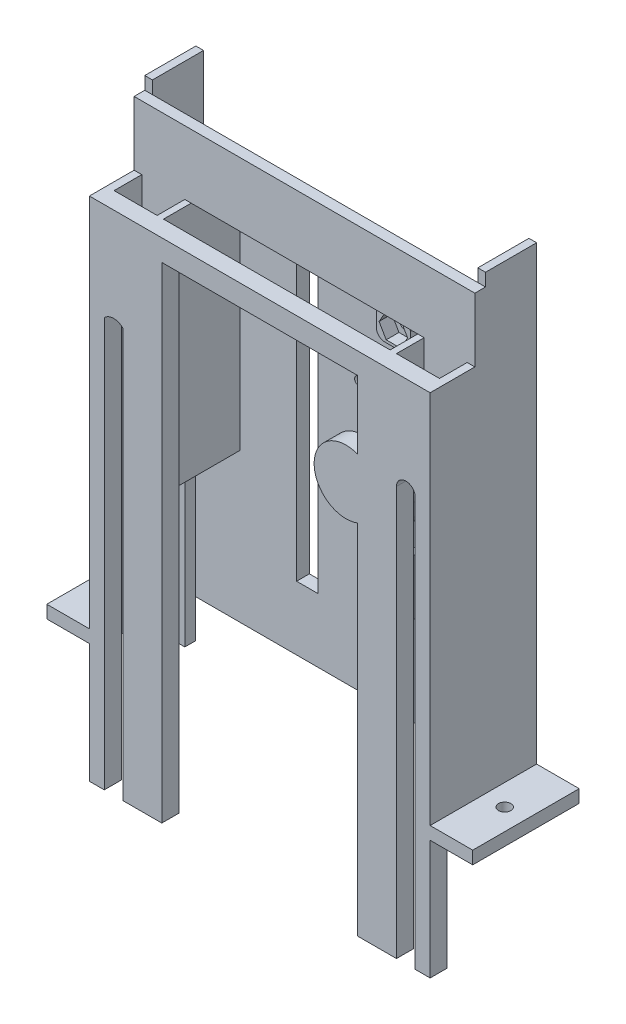
from build123d import *

# Parameters (mm, degrees)
SKETCH1_W            = 9.1
SKETCH1_H            = 51
SKETCH1_W_2          = 23
SKETCH1_H_2          = 5
BOSS_EXTRUDE1_DEPTH  = 4
SKETCH2_W            = 1.8
SKETCH2_H            = 56
SKETCH2_W_2          = 1.5
BOSS_EXTRUDE2_DEPTH  = 5
SKETCH3_W            = 1.5
SKETCH3_H            = 30
CUT_EXTRUDE1_DEPTH   = 5
SKETCH4_W            = 1.8
SKETCH4_H            = 13
SKETCH4_W_2          = 1.5
SKETCH4_H_2          = 3
SKETCH4_W_3          = 10.1
SKETCH4_W_4          = 53.2
BOSS_EXTRUDE3_DEPTH  = 56
SKETCH5_R            = 1.75
SKETCH5_R_2          = 4.75
CUT_EXTRUDE2_DEPTH   = 3
SKETCH6_W            = 8
SKETCH6_H            = 7
BOSS_EXTRUDE4_DEPTH  = 3
FILLET1_R            = 2
SKETCH7_W            = 1.5
SKETCH7_H            = 30
CUT_EXTRUDE3_DEPTH   = 7
SKETCH8_W            = 5
SKETCH8_H            = 50
CUT_EXTRUDE4_DEPTH   = 3
SKETCH11_W           = 7
SKETCH11_H           = 3
BOSS_EXTRUDE5_DEPTH  = 10
SKETCH12_W           = 25
SKETCH12_H           = 3
BOSS_EXTRUDE6_DEPTH  = 10
SKETCH13_W           = 25
SKETCH13_H           = 3
BOSS_EXTRUDE7_DEPTH  = 10
SKETCH14_R           = 1.75
CUT_EXTRUDE6_DEPTH   = 3
BOSS_EXTRUDE8_START  = -4
BOSS_EXTRUDE8_DEPTH  = 4
SKETCH17_W           = 3.4
SKETCH17_H           = 32.199052503
CUT_EXTRUDE8_DEPTH   = 4
SKETCH18_W           = 23
SKETCH18_H           = 12
CUT_EXTRUDE9_DEPTH   = 10
SKETCH19_W           = 76.4
SKETCH19_H           = 18
BOSS_EXTRUDE10_DEPTH = 35
SKETCH21_R           = 1.45
CUT_EXTRUDE11_DEPTH  = 109.360509412
SKETCH20_W           = 10
SKETCH20_H           = 25
SKETCH20_W_2         = 7
SKETCH20_H_2         = 10
CUT_EXTRUDE10_DEPTH  = 35
SKETCH22_W           = 4.4
SKETCH22_H           = 35
CUT_EXTRUDE12_DEPTH  = 10
SKETCH23_W           = 46
SKETCH23_H           = 35
CUT_EXTRUDE13_DEPTH  = 10
SKETCH25_W           = 1.8
SKETCH25_H           = 12
BOSS_EXTRUDE12_DEPTH = 18
SKETCH27_R           = 1
CUT_EXTRUDE15_DEPTH  = 5
SKETCH28_W           = 7
SKETCH28_H           = 10
CUT_EXTRUDE16_DEPTH  = 122.231184107
SKETCH29_W           = 7
SKETCH29_H           = 10
BOSS_EXTRUDE13_DEPTH = 2
SKETCH30_R           = 1.5
CUT_EXTRUDE17_DEPTH  = 109.360509412
BOSS_EXTRUDE14_DEPTH = 4
SKETCH33_W           = 3.5
SKETCH33_H           = 4
SKETCH33_W_2         = 9.1
BOSS_EXTRUDE15_DEPTH = 28
BOSS_EXTRUDE16_DEPTH = 4
SKETCH35_W           = 80
SKETCH35_H           = 15
BOSS_EXTRUDE17_DEPTH = 2.5
SKETCH36_W           = 10.1
SKETCH36_H           = 2.5
BOSS_EXTRUDE18_DEPTH = 91
SKETCH37_W           = 5
SKETCH37_H           = 20
CUT_EXTRUDE18_DEPTH  = 5


with BuildPart() as part:
    # Sketch1 → Boss-Extrude1 (new body)
    with BuildSketch(Plane.XY):
        with BuildLine():
            Line((-23, 23), (-23, 28))
            Line((-23, 28), (-40, 28))
            Line((-40, 28), (-40, -28))
            Line((-40, -28), (-36.5, -28))
            Line((-36.5, -28), (-36.5, 23))
            ThreePointArc((-36.5, 23), (-34.3, 25.2), (-32.1, 23))
            Line((-32.1, 23), (-23, 23))
        make_face()
        with Locations((-27.55, -2.5)):
            Rectangle(SKETCH1_W, SKETCH1_H)
        with Locations((-11.5, 25.5)):
            Rectangle(SKETCH1_W_2, SKETCH1_H_2)
        with Locations((27.55, -2.5)):
            Rectangle(SKETCH1_W, SKETCH1_H)
        with Locations((11.5, 25.5)):
            Rectangle(SKETCH1_W_2, SKETCH1_H_2)
        with BuildLine():
            Line((40, 28), (23, 28))
            Line((23, 28), (23, 23))
            Line((23, 23), (32.1, 23))
            ThreePointArc((32.1, 23), (34.3, 25.2), (36.5, 23))
            Line((36.5, 23), (36.5, -28))
            Line((36.5, -28), (40, -28))
            Line((40, -28), (40, 28))
        make_face()
    extrude(amount=BOSS_EXTRUDE1_DEPTH)

    # Sketch2 → Boss-Extrude2 (add)
    with BuildSketch(Plane(origin=(0, 0, 0), x_dir=(-1, 0, 0), z_dir=(0, 0, -1))):
        with Locations((-39.1, 0)):
            Rectangle(SKETCH2_W, SKETCH2_H)
        with Locations((-27.35, 0)):
            Rectangle(SKETCH2_W_2, SKETCH2_H)
        with Locations((27.35, 0)):
            Rectangle(SKETCH2_W_2, SKETCH2_H)
        with Locations((39.1, 0)):
            Rectangle(SKETCH2_W, SKETCH2_H)
    extrude(amount=BOSS_EXTRUDE2_DEPTH)

    # Sketch3 → Cut-Extrude1 (cut)
    with BuildSketch(Plane(origin=(0, 0, -5), x_dir=(-1, 0, 0), z_dir=(0, 0, -1))):
        with Locations((-27.35, 0)):
            Rectangle(SKETCH3_W, SKETCH3_H)
    extrude(amount=-CUT_EXTRUDE1_DEPTH, mode=Mode.SUBTRACT)

    # Sketch4 → Boss-Extrude3 (add)
    with BuildSketch(Plane(origin=(0, 28, 0), x_dir=(1, 0, 0), z_dir=(0, 1, 0))):
        with Locations((-39.1, 11.5)):
            Rectangle(SKETCH4_W, SKETCH4_H)
        with Locations((-27.35, 11.5)):
            Rectangle(SKETCH4_W_2, SKETCH4_H)
        with Locations((-27.35, 19.5)):
            Rectangle(SKETCH4_W_2, SKETCH4_H_2)
        with Locations((-33.15, 19.5)):
            Rectangle(SKETCH4_W_3, SKETCH4_H_2)
        with Locations((-39.1, 19.5)):
            Rectangle(SKETCH4_W, SKETCH4_H_2)
        with Locations((0, 19.5)):
            Rectangle(SKETCH4_W_4, SKETCH4_H_2)
        with Locations((27.35, 11.5)):
            Rectangle(SKETCH4_W_2, SKETCH4_H)
        with Locations((27.35, 19.5)):
            Rectangle(SKETCH4_W_2, SKETCH4_H_2)
        with Locations((33.15, 19.5)):
            Rectangle(SKETCH4_W_3, SKETCH4_H_2)
        with Locations((39.1, 19.5)):
            Rectangle(SKETCH4_W, SKETCH4_H_2)
        with Locations((39.1, 11.5)):
            Rectangle(SKETCH4_W, SKETCH4_H)
    extrude(amount=-BOSS_EXTRUDE3_DEPTH)

    # Sketch5 → Cut-Extrude2 (cut)
    with BuildSketch(Plane(origin=(0, 0, -21), x_dir=(-1, 0, 0), z_dir=(0, 0, -1))):
        with Locations((-12.36, 17.5)):
            Circle(SKETCH5_R)
        with Locations((-12.36, -17.5)):
            Circle(SKETCH5_R)
        with Locations((-20.26, 0)):
            Circle(SKETCH5_R_2)
    extrude(amount=-CUT_EXTRUDE2_DEPTH, mode=Mode.SUBTRACT)

    # Sketch6 → Boss-Extrude4 (add)
    # profile 1 of 2: a face of its own
    with BuildSketch(Plane.XY.offset(-18)):
        with Locations((12.36, 17.5)):
            Rectangle(SKETCH6_W, SKETCH6_H)
        Polygon((10.685684219, 14.6), (14.034315781, 14.6), (15.708631561, 17.5), (14.034315781, 20.4), (10.685684219, 20.4), (9.011368439, 17.5), align=None, mode=Mode.SUBTRACT)
    # profile 2 of 2: a face of its own
    with BuildSketch(Plane.XY.offset(-18)):
        with Locations((12.36, -17.5)):
            Rectangle(SKETCH6_W, SKETCH6_H)
        Polygon((10.685684219, -20.4), (14.034315781, -20.4), (15.708631561, -17.5), (14.034315781, -14.6), (10.685684219, -14.6), (9.011368439, -17.5), align=None, mode=Mode.SUBTRACT)
    extrude(amount=BOSS_EXTRUDE4_DEPTH)

    # Fillet1
    fillet1_edges = [part.edges().sort_by_distance(p)[0] for p in [
        (16.36, 14, -16.5),
        (16.36, 21, -16.5),
        (8.36, 21, -16.5),
        (8.36, 14, -16.5),
        (16.36, -21, -16.5),
        (16.36, -14, -16.5),
        (8.36, -14, -16.5),
        (8.36, -21, -16.5),
    ]]
    fillet(fillet1_edges, radius=FILLET1_R)

    # Sketch7 → Cut-Extrude3 (cut)
    with BuildSketch(Plane.XY.offset(-5)):
        with Locations((27.35, 0)):
            Rectangle(SKETCH7_W, SKETCH7_H)
    extrude(amount=-CUT_EXTRUDE3_DEPTH, mode=Mode.SUBTRACT)

    # Sketch8 → Cut-Extrude4 (cut)
    with BuildSketch(Plane(origin=(0, 0, -21), x_dir=(-1, 0, 0), z_dir=(0, 0, -1))):
        with Locations((10.85, -3)):
            Rectangle(SKETCH8_W, SKETCH8_H)
        with BuildLine():
            ThreePointArc((8.35, 22), (10.85, 24.5), (13.35, 22))
            Line((13.35, 22), (8.35, 22))
        make_face()
    extrude(amount=-CUT_EXTRUDE4_DEPTH, mode=Mode.SUBTRACT)

    # Sketch11 → Boss-Extrude5 (add)
    with BuildSketch(Plane(origin=(0, 0, -21), x_dir=(-1, 0, 0), z_dir=(0, 0, -1))):
        with Locations((-20.5, -26.5)):
            Rectangle(SKETCH11_W, SKETCH11_H)
        with Locations((20.5, -26.5)):
            Rectangle(SKETCH11_W, SKETCH11_H)
    extrude(amount=BOSS_EXTRUDE5_DEPTH)

    # Sketch12 → Boss-Extrude6 (add)
    with BuildSketch(Plane(origin=(40, 0, 0), x_dir=(0, 0, -1), z_dir=(1, 0, 0))):
        with Locations((8.5, -26.5)):
            Rectangle(SKETCH12_W, SKETCH12_H)
    extrude(amount=BOSS_EXTRUDE6_DEPTH)

    # Sketch13 → Boss-Extrude7 (add)
    with BuildSketch(Plane.ZY.offset(40)):
        with Locations((-8.5, -26.5)):
            Rectangle(SKETCH13_W, SKETCH13_H)
    extrude(amount=BOSS_EXTRUDE7_DEPTH)

    # Sketch14 → Cut-Extrude6 (cut)
    with BuildSketch(Plane(origin=(0, -25, 0), x_dir=(1, 0, 0), z_dir=(0, 1, 0))):
        with Locations(Location((20.5, 26, 0), (0, 0, 180))):
            Circle(SKETCH14_R)
        with Locations(Location((45, 8.5, 0), (0, 0, 180))):
            Circle(SKETCH14_R)
        with Locations(Location((-20.5, 26, 0), (0, 0, 180))):
            Circle(SKETCH14_R)
        with Locations(Location((-45, 8.5, 0), (0, 0, 180))):
            Circle(SKETCH14_R)
    extrude(amount=-CUT_EXTRUDE6_DEPTH, mode=Mode.SUBTRACT)

    # Sketch15 → Boss-Extrude8 (add)
    with BuildSketch(Plane.XY.offset(4).offset(BOSS_EXTRUDE8_START)):
        with BuildLine():
            ThreePointArc((23, 3.880064432), (24.477671158, 2.184891302), (25.01, 0))
            ThreePointArc((25.01, 0), (24.477671158, -2.184891302), (23, -3.880064432))
            Line((23, -3.880064432), (23, -6.981575753))
            ThreePointArc((23, -6.981575753), (26.456773354, -4.224926035), (27.76, 0))
            ThreePointArc((27.76, 0), (26.456773354, 4.224926035), (23, 6.981575753))
            Line((23, 6.981575753), (23, 3.880064432))
        make_face()
        with BuildLine():
            ThreePointArc((23, -3.880064432), (15.51, 0), (23, 3.880064432))
            Line((23, 3.880064432), (23, 6.981575753))
            ThreePointArc((23, 6.981575753), (12.76, 0), (23, -6.981575753))
            Line((23, -6.981575753), (23, -3.880064432))
        make_face()
        with BuildLine():
            ThreePointArc((23, -3.880064432), (24.477671158, -2.184891302), (25.01, 0))
            ThreePointArc((25.01, 0), (24.477671158, 2.184891302), (23, 3.880064432))
            Line((23, 3.880064432), (23, -3.880064432))
        make_face()
        with BuildLine():
            Line((23, -3.880064432), (23, 3.880064432))
            ThreePointArc((23, 3.880064432), (15.51, 0), (23, -3.880064432))
        make_face()
    extrude(amount=BOSS_EXTRUDE8_DEPTH)

    # Sketch17 → Cut-Extrude8 (cut)
    with BuildSketch(Plane(origin=(0, 0, -21), x_dir=(-1, 0, 0), z_dir=(0, 0, -1))):
        with Locations((34.3, 6.900473748)):
            Rectangle(SKETCH17_W, SKETCH17_H)
        with Locations((-34.3, 6.900473748)):
            Rectangle(SKETCH17_W, SKETCH17_H)
    extrude(amount=-CUT_EXTRUDE8_DEPTH, mode=Mode.SUBTRACT)

    # Sketch18 → Cut-Extrude9 (cut)
    with BuildSketch(Plane(origin=(0, 0, -21), x_dir=(-1, 0, 0), z_dir=(0, 0, -1))):
        with Locations((-14.76, 0)):
            Rectangle(SKETCH18_W, SKETCH18_H)
    extrude(amount=-CUT_EXTRUDE9_DEPTH, mode=Mode.SUBTRACT)

    # Sketch19 → Boss-Extrude10 (add)
    with BuildSketch(Plane.XZ.offset(28)):
        Polygon((-50, 4), (-38.2, 4), (38.2, 4), (50, 4), (50, -21), (38.2, -21), (24, -21), (24, -31), (17, -31), (17, -21), (-17, -21), (-17, -31), (-24, -31), (-24, -21), (-38.2, -21), (-50, -21), align=None)
        with Locations((0, -9)):
            Rectangle(SKETCH19_W, SKETCH19_H, mode=Mode.SUBTRACT)
    extrude(amount=BOSS_EXTRUDE10_DEPTH)

    # Sketch21 → Cut-Extrude11 (cut, through all)
    with BuildSketch(Plane.XZ.offset(63)):
        with Locations(Location((45, -8.5, 0), (0, 0, 270))):
            Circle(SKETCH21_R)
        with Locations(Location((20.5, -26, 0), (0, 0, 270))):
            Circle(SKETCH21_R)
        with Locations(Location((-20.5, -26, 0), (0, 0, 270))):
            Circle(SKETCH21_R)
        with Locations(Location((-45, -8.5, 0), (0, 0, 270))):
            Circle(SKETCH21_R)
    extrude(amount=-CUT_EXTRUDE11_DEPTH, mode=Mode.SUBTRACT)

    # Sketch20 → Cut-Extrude10 (cut)
    with BuildSketch(Plane(origin=(0, -25, 0), x_dir=(1, 0, 0), z_dir=(0, 1, 0))):
        with Locations((-45, 8.5)):
            Rectangle(SKETCH20_W, SKETCH20_H)
        with Locations((45, 8.5)):
            Rectangle(SKETCH20_W, SKETCH20_H)
        with Locations((-20.5, 26)):
            Rectangle(SKETCH20_W_2, SKETCH20_H_2)
        with Locations((20.5, 26)):
            Rectangle(SKETCH20_W_2, SKETCH20_H_2)
    extrude(amount=-CUT_EXTRUDE10_DEPTH, mode=Mode.SUBTRACT)

    # Sketch22 → Cut-Extrude12 (cut)
    with BuildSketch(Plane.XY.offset(4)):
        with Locations((-34.3, -45.5)):
            Rectangle(SKETCH22_W, SKETCH22_H)
        with Locations((34.3, -45.5)):
            Rectangle(SKETCH22_W, SKETCH22_H)
    extrude(amount=-CUT_EXTRUDE12_DEPTH, mode=Mode.SUBTRACT)

    # Sketch23 → Cut-Extrude13 (cut)
    with BuildSketch(Plane.XY.offset(4)):
        with Locations((0, -45.5)):
            Rectangle(SKETCH23_W, SKETCH23_H)
    extrude(amount=-CUT_EXTRUDE13_DEPTH, mode=Mode.SUBTRACT)

    # Sketch25 → Boss-Extrude12 (add)
    with BuildSketch(Plane(origin=(0, 28, 0), x_dir=(1, 0, 0), z_dir=(0, 1, 0))):
        with Locations((39.1, 15)):
            Rectangle(SKETCH25_W, SKETCH25_H)
        with Locations((-39.1, 15)):
            Rectangle(SKETCH25_W, SKETCH25_H)
    extrude(amount=BOSS_EXTRUDE12_DEPTH)

    # Sketch27 → Cut-Extrude15 (cut)
    with BuildSketch(Plane(origin=(0, 0, -21), x_dir=(-1, 0, 0), z_dir=(0, 0, -1))):
        with Locations((-1.26, 0)):
            Circle(SKETCH27_R)
        with Locations((-28.56, 0)):
            Circle(SKETCH27_R)
    extrude(amount=-CUT_EXTRUDE15_DEPTH, mode=Mode.SUBTRACT)

    # Sketch28 → Cut-Extrude16 (cut, through all)
    with BuildSketch(Plane(origin=(0, -60, 0), x_dir=(1, 0, 0), z_dir=(0, 1, 0))):
        with Locations((20.5, 26)):
            Rectangle(SKETCH28_W, SKETCH28_H)
        with Locations((-20.5, 26)):
            Rectangle(SKETCH28_W, SKETCH28_H)
    extrude(amount=-CUT_EXTRUDE16_DEPTH, mode=Mode.SUBTRACT)

    # Sketch29 → Boss-Extrude13 (add)
    with BuildSketch(Plane(origin=(0, -63, 0), x_dir=(1, 0, 0), z_dir=(0, 1, 0))):
        with Locations((13.1, 26)):
            Rectangle(SKETCH29_W, SKETCH29_H)
        with Locations((-13.1, 26)):
            Rectangle(SKETCH29_W, SKETCH29_H)
    extrude(amount=BOSS_EXTRUDE13_DEPTH)

    # Sketch30 → Cut-Extrude17 (cut, through all)
    with BuildSketch(Plane(origin=(0, 28, 0), x_dir=(1, 0, 0), z_dir=(0, 1, 0))):
        with Locations(Location((13.1, 26.5, 0), (0, 0, 180))):
            Circle(SKETCH30_R)
        with Locations(Location((-13.1, 26.5, 0), (0, 0, 180))):
            Circle(SKETCH30_R)
    extrude(amount=-CUT_EXTRUDE17_DEPTH, mode=Mode.SUBTRACT)

    # Sketch32 → Boss-Extrude14 (add)
    with BuildSketch(Plane.XY.offset(4)):
        with BuildLine():
            Line((-38, 26), (-30, 26))
            Line((-30, 26), (-30, 5))
            Line((-30, 5), (-32.1, 5))
            ThreePointArc((-32.1, 5), (-34.3, 5.960392195), (-36.5, 5))
            Line((-36.5, 5), (-38, 5))
            Line((-38, 5), (-38, 26))
        make_face()
    extrude(amount=-BOSS_EXTRUDE14_DEPTH)

    # Sketch33 → Boss-Extrude15 (add)
    with BuildSketch(Plane.XZ.offset(63)):
        with Locations((38.25, 2)):
            Rectangle(SKETCH33_W, SKETCH33_H)
        with Locations((-38.25, 2)):
            Rectangle(SKETCH33_W, SKETCH33_H)
        with Locations((-27.55, 2)):
            Rectangle(SKETCH33_W_2, SKETCH33_H)
        with Locations((27.55, 2)):
            Rectangle(SKETCH33_W_2, SKETCH33_H)
    extrude(amount=BOSS_EXTRUDE15_DEPTH)

    # Sketch34 → Boss-Extrude16 (add)
    with BuildSketch(Plane.XY.offset(4)):
        with BuildLine():
            Line((30, 26), (38, 26))
            Line((38, 26), (38, 5))
            Line((38, 5), (36.5, 5))
            ThreePointArc((36.5, 5), (34.3, 7.2), (32.1, 5))
            Line((32.1, 5), (30, 5))
            Line((30, 5), (30, 26))
        make_face()
    extrude(amount=-BOSS_EXTRUDE16_DEPTH)

    # Sketch35 → Boss-Extrude17 (add)
    with BuildSketch(Plane.XY.offset(-9)):
        with Locations((0, 35.5)):
            Rectangle(SKETCH35_W, SKETCH35_H)
    extrude(amount=BOSS_EXTRUDE17_DEPTH)

    # Sketch36 → Boss-Extrude18 (add)
    with BuildSketch(Plane.XZ.offset(-28)):
        with Locations((-33.15, -7.75)):
            Rectangle(SKETCH36_W, SKETCH36_H)
        with Locations((33.15, -7.75)):
            Rectangle(SKETCH36_W, SKETCH36_H)
    extrude(amount=BOSS_EXTRUDE18_DEPTH)

    # Sketch37 → Cut-Extrude18 (cut)
    with BuildSketch(Plane(origin=(0, 0, -21), x_dir=(-1, 0, 0), z_dir=(0, 0, -1))):
        with Locations((10.85, -38)):
            Rectangle(SKETCH37_W, SKETCH37_H)
    extrude(amount=-CUT_EXTRUDE18_DEPTH, mode=Mode.SUBTRACT)


solid = part.part
